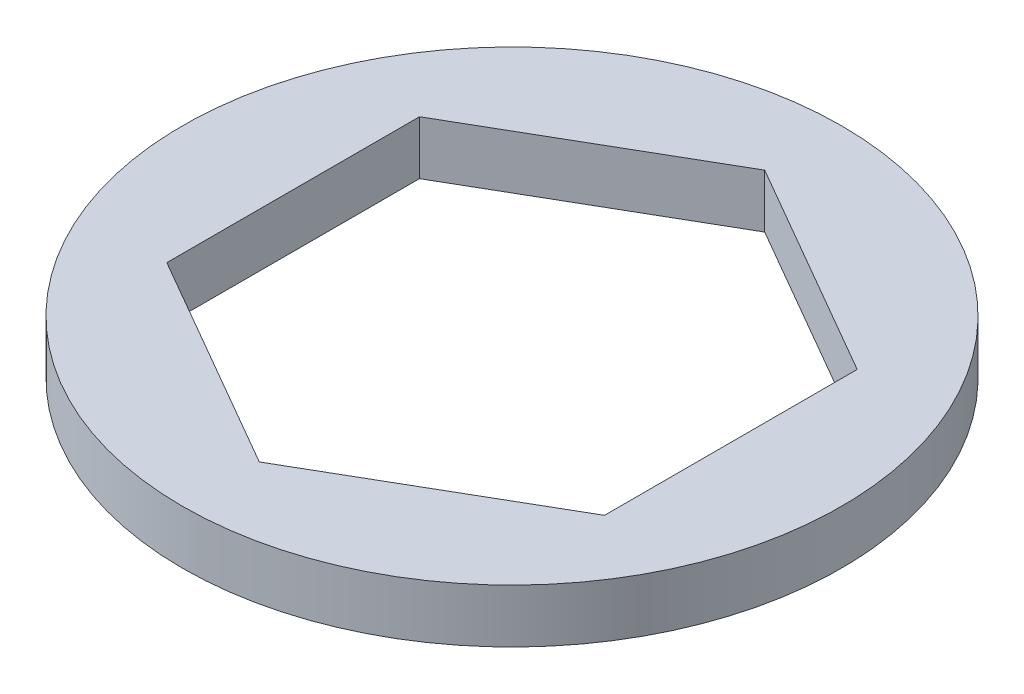
from build123d import *

# Parameters (mm, degrees)
SKETCH1_R           = 9.7536
BOSS_EXTRUDE1_DEPTH = 1.5875


with BuildPart() as part:
    # Sketch1 → Boss-Extrude1 (new body)
    with BuildSketch(Plane(origin=(0, 0, 0), x_dir=(1, 0, 0), z_dir=(0, 1, 0))):
        with Locations(Location((0, 0, 0), (0, 0, 270))):
            Circle(SKETCH1_R)
        Polygon((0, 7.478995387), (-6.477, 3.739497694), (-6.477, -3.739497694), (0, -7.478995387), (6.477, -3.739497694), (6.477, 3.739497694), align=None, mode=Mode.SUBTRACT)
    extrude(amount=BOSS_EXTRUDE1_DEPTH)


solid = part.part
